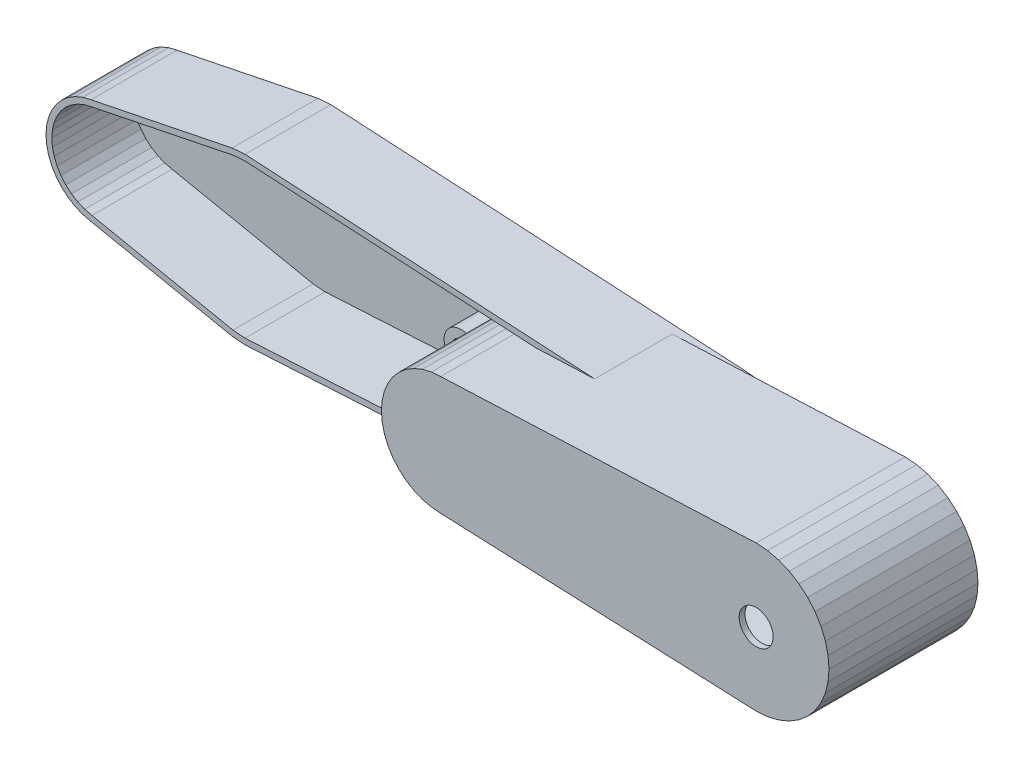
from build123d import *

# Parameters (mm, degrees)
BOSS_EXTRUDE1_START = -22.2
BOSS_EXTRUDE1_DEPTH = 17.7
CUT_EXTRUDE1_START  = -21
CUT_EXTRUDE1_DEPTH  = 16.6
BOSS_EXTRUDE2_START = -20.5
BOSS_EXTRUDE2_DEPTH = 30.7
CUT_EXTRUDE2_START  = -20.6
CUT_EXTRUDE2_DEPTH  = 29.6
CUT_EXTRUDE3_START  = 8.9
SKETCH5_R           = 3.5
CUT_EXTRUDE3_DEPTH  = 1.4
CUT_EXTRUDE4_START  = -20.6
SKETCH6_W           = 17
SKETCH6_H           = 17.2
CUT_EXTRUDE4_DEPTH  = 17
BOSS_EXTRUDE3_START = -21
SKETCH7_R           = 3.5
BOSS_EXTRUDE3_DEPTH = 12
CUT_EXTRUDE5_START  = -22.3
SKETCH8_R           = 1.725
CUT_EXTRUDE5_DEPTH  = 13.3


with BuildPart() as part:
    # Sketch1 → Boss-Extrude1 (new body)
    with BuildSketch(Plane.XY.offset(BOSS_EXTRUDE1_START)):
        Polygon((-41, 0), (-40.8646, -1.7208), (-40.4616, -3.3992), (-39.8011, -4.9939), (-38.8992, -6.4656), (-37.7782, -7.7782), (-36.4656, -8.8992), (-34.9939, -9.8011), (-33.3992, -10.4616), (-31.7208, -10.8646), (-2.6594, -16.7907), (0, -17), (85, -12.2), (86.9085, -12.0498), (88.77, -11.6029), (90.5387, -10.8703), (92.171, -9.87), (93.6267, -8.6267), (94.87, -7.171), (95.8703, -5.5387), (96.6029, -3.77), (97.0498, -1.9085), (97.2, 0), (97.0498, 1.9085), (96.6029, 3.77), (95.8703, 5.5387), (94.87, 7.171), (93.6267, 8.6267), (92.171, 9.87), (90.5387, 10.8703), (88.77, 11.6029), (86.9085, 12.0498), (85, 12.2), (0, 17), (-2.6594, 16.7907), (-31.7208, 10.8646), (-33.3992, 10.4616), (-34.9939, 9.8011), (-36.4656, 8.8992), (-37.7782, 7.7782), (-38.8992, 6.4656), (-39.8011, 4.9939), (-40.4616, 3.3992), (-40.8646, 1.7208), align=None)
    extrude(amount=BOSS_EXTRUDE1_DEPTH)

    # Sketch2 → Cut-Extrude1 (cut)
    with BuildSketch(Plane.XY.offset(CUT_EXTRUDE1_START)):
        Polygon((-39.8, 0), (-39.6793, -1.5331), (-39.3204, -3.0284), (-38.7319, -4.4491), (-37.9284, -5.7603), (-36.9296, -6.9296), (-35.7603, -7.9284), (-34.4491, -8.7319), (-33.0284, -9.3204), (-31.5331, -9.6793), (-2.4717, -15.6055), (0, -15.8), (85, -11), (86.7208, -10.8646), (88.3992, -10.4616), (89.9939, -9.8011), (91.4656, -8.8992), (92.7782, -7.7782), (93.8992, -6.4656), (94.8011, -4.9939), (95.4616, -3.3992), (95.8646, -1.7208), (96, 0), (95.8646, 1.7208), (95.4616, 3.3992), (94.8011, 4.9939), (93.8992, 6.4656), (92.7782, 7.7782), (91.4656, 8.8992), (89.9939, 9.8011), (88.3992, 10.4616), (86.7208, 10.8646), (85, 11), (0, 15.8), (-2.4717, 15.6055), (-31.5331, 9.6793), (-33.0284, 9.3204), (-34.4491, 8.7319), (-35.7603, 7.9284), (-36.9296, 6.9296), (-37.9284, 5.7603), (-38.7319, 4.4491), (-39.3204, 3.0284), (-39.6793, 1.5331), align=None)
    extrude(amount=CUT_EXTRUDE1_DEPTH, mode=Mode.SUBTRACT)

    # Sketch3 → Boss-Extrude2 (add)
    with BuildSketch(Plane.XY.offset(BOSS_EXTRUDE2_START)):
        Polygon((42.8, 0), (42.9502, -1.9085), (43.3971, -3.77), (44.1297, -5.5387), (45.13, -7.171), (46.3733, -8.6267), (47.829, -9.87), (49.4613, -10.8703), (51.23, -11.6029), (53.0915, -12.0498), (55, -12.2), (120, -15), (122.3465, -14.8153), (124.6353, -14.2658), (126.8099, -13.3651), (128.8168, -12.1353), (130.6066, -10.6066), (132.1353, -8.8168), (133.3651, -6.8099), (134.2658, -4.6353), (134.8153, -2.3465), (135, 0), (134.8153, 2.3465), (134.2658, 4.6353), (133.3651, 6.8099), (132.1353, 8.8168), (130.6066, 10.6066), (128.8168, 12.1353), (126.8099, 13.3651), (124.6353, 14.2658), (122.3465, 14.8153), (120, 15), (55, 12.2), (53.0915, 12.0498), (51.23, 11.6029), (49.4613, 10.8703), (47.829, 9.87), (46.3733, 8.6267), (45.13, 7.171), (44.1297, 5.5387), (43.3971, 3.77), (42.9502, 1.9085), align=None)
    extrude(amount=BOSS_EXTRUDE2_DEPTH)

    # Sketch4 → Cut-Extrude2 (cut)
    with BuildSketch(Plane.XY.offset(CUT_EXTRUDE2_START)):
        Polygon((44, 0), (44.1354, -1.7208), (44.5384, -3.3992), (45.1989, -4.9939), (46.1008, -6.4656), (47.2218, -7.7782), (48.5344, -8.8992), (50.0061, -9.8011), (51.6008, -10.4616), (53.2792, -10.8646), (55, -11), (120, -13.8), (122.1588, -13.6301), (124.2644, -13.1246), (126.2651, -12.2959), (128.1114, -11.1644), (129.7581, -9.7581), (131.1644, -8.1114), (132.2959, -6.2651), (133.1246, -4.2644), (133.6301, -2.1588), (133.8, 0), (133.6301, 2.1588), (133.1246, 4.2644), (132.2959, 6.2651), (131.1644, 8.1114), (129.7581, 9.7581), (128.1114, 11.1644), (126.2651, 12.2959), (124.2644, 13.1246), (122.1588, 13.6301), (120, 13.8), (55, 11), (53.2792, 10.8646), (51.6008, 10.4616), (50.0061, 9.8011), (48.5344, 8.8992), (47.2218, 7.7782), (46.1008, 6.4656), (45.1989, 4.9939), (44.5384, 3.3992), (44.1354, 1.7208), align=None)
    extrude(amount=CUT_EXTRUDE2_DEPTH, mode=Mode.SUBTRACT)

    # Sketch5 → Cut-Extrude3 (cut)
    with BuildSketch(Plane.XY.offset(CUT_EXTRUDE3_START)):
        with Locations((120, 0)):
            Circle(SKETCH5_R)
    extrude(amount=CUT_EXTRUDE3_DEPTH, mode=Mode.SUBTRACT)

    # Sketch6 → Cut-Extrude4 (cut)
    with BuildSketch(Plane.XY.offset(CUT_EXTRUDE4_START)):
        with Locations((48.5, 0)):
            Rectangle(SKETCH6_W, SKETCH6_H)
    extrude(amount=CUT_EXTRUDE4_DEPTH, mode=Mode.SUBTRACT)

    # Sketch7 → Boss-Extrude3 (add)
    with BuildSketch(Plane.XY.offset(BOSS_EXTRUDE3_START)):
        with Locations((40, 0)):
            Circle(SKETCH7_R)
        with Locations((75, 0)):
            Circle(SKETCH7_R)
    extrude(amount=BOSS_EXTRUDE3_DEPTH)

    # Sketch8 → Cut-Extrude5 (cut)
    with BuildSketch(Plane.XY.offset(CUT_EXTRUDE5_START)):
        with Locations(Location((40, 0, 0), (0, 0, 180))):
            Circle(SKETCH8_R)
        with Locations(Location((75, 0, 0), (0, 0, 180))):
            Circle(SKETCH8_R)
    extrude(amount=CUT_EXTRUDE5_DEPTH, mode=Mode.SUBTRACT)


solid = part.part
